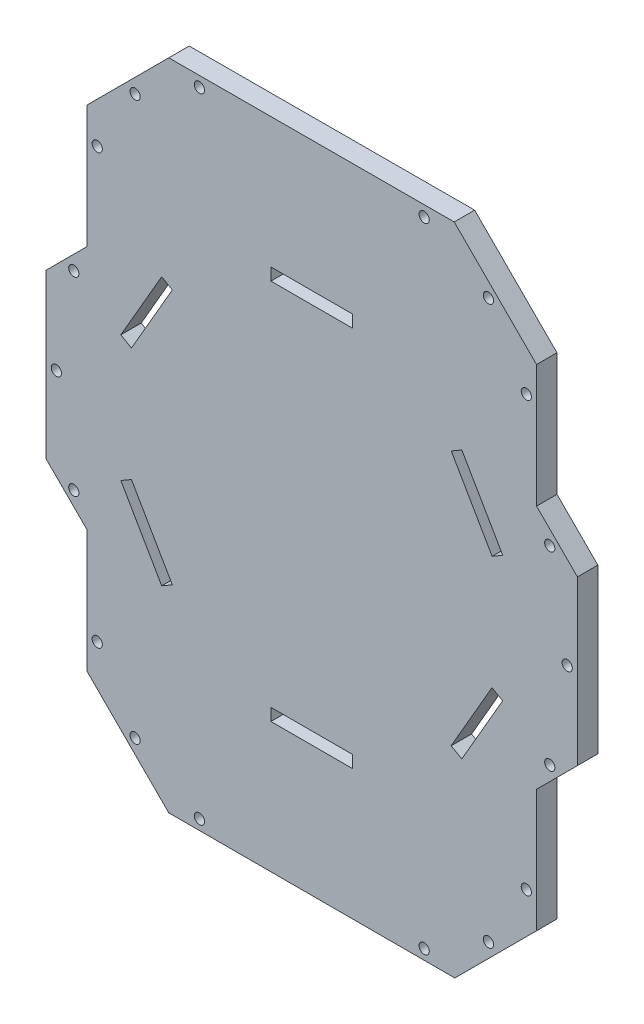
from build123d import *

# Parameters (mm, degrees)
MODEL_R             = 1.25
MODEL_W             = 20
MODEL_H             = 3
BOSS_EXTRUDE1_DEPTH = 5


with BuildPart() as part:
    # Model → Boss-Extrude1 (new body)
    with BuildSketch(Plane.XY):
        Polygon((112.443761684, 7.565594359), (132.443761684, 27.565594359), (132.443761684, 57.565594359), (142.443761684, 67.565594359), (142.443761684, 107.565594359), (132.443761684, 117.565594359), (132.443761684, 147.565594359), (112.298529785, 167.710826258), (42.447520771, 167.569353446), (22.443761684, 147.565594359), (22.443761684, 117.565594359), (12.443761684, 107.565594359), (12.443761684, 67.565594359), (22.443761684, 57.565594359), (22.443761684, 27.565594359), (42.443761684, 7.565594359), align=None)
        with Locations((104.943761684, 10.065594359)):
            Circle(MODEL_R, mode=Mode.SUBTRACT)
        with Locations((129.943761684, 35.065594359)):
            Circle(MODEL_R, mode=Mode.SUBTRACT)
        with Locations((120.675994731, 19.333361312)):
            Circle(MODEL_R, mode=Mode.SUBTRACT)
        with Locations((49.943761684, 10.065594359)):
            Circle(MODEL_R, mode=Mode.SUBTRACT)
        with Locations((24.943761684, 35.065594359)):
            Circle(MODEL_R, mode=Mode.SUBTRACT)
        with Locations((34.211528637, 19.333361312)):
            Circle(MODEL_R, mode=Mode.SUBTRACT)
        with Locations((104.943761684, 165.065594359)):
            Circle(MODEL_R, mode=Mode.SUBTRACT)
        with Locations((129.943761684, 140.065594359)):
            Circle(MODEL_R, mode=Mode.SUBTRACT)
        with Locations((120.675994731, 155.797827406)):
            Circle(MODEL_R, mode=Mode.SUBTRACT)
        with Locations((49.943761684, 165.065594359)):
            Circle(MODEL_R, mode=Mode.SUBTRACT)
        with Locations((24.943761684, 140.065594359)):
            Circle(MODEL_R, mode=Mode.SUBTRACT)
        with Locations((34.211528637, 155.797827406)):
            Circle(MODEL_R, mode=Mode.SUBTRACT)
        with Locations((19.211528637, 64.333361312)):
            Circle(MODEL_R, mode=Mode.SUBTRACT)
        with Locations((14.943761684, 87.565594359)):
            Circle(MODEL_R, mode=Mode.SUBTRACT)
        with Locations((19.211528637, 110.797827406)):
            Circle(MODEL_R, mode=Mode.SUBTRACT)
        with Locations((135.675994731, 64.333361312)):
            Circle(MODEL_R, mode=Mode.SUBTRACT)
        with Locations((139.943761684, 87.565594359)):
            Circle(MODEL_R, mode=Mode.SUBTRACT)
        with Locations((135.675994731, 110.797827406)):
            Circle(MODEL_R, mode=Mode.SUBTRACT)
        with Locations((77.443761684, 134.246405176)):
            Rectangle(MODEL_W, MODEL_H, mode=Mode.SUBTRACT)
        with Locations((77.443761684, 40.923947526)):
            Rectangle(MODEL_W, MODEL_H, mode=Mode.SUBTRACT)
        Polygon((111.546053861, 56.329621407), (114.144130073, 54.829621407), (124.144130073, 72.150129482), (121.546053861, 73.650129482), align=None, mode=Mode.SUBTRACT)
        Polygon((114.169567826, 120.316253805), (111.571491615, 118.816253805), (121.571491615, 101.49574573), (124.169567826, 102.99574573), align=None, mode=Mode.SUBTRACT)
        Polygon((40.717955541, 54.814934913), (43.316031753, 56.314934913), (33.316031753, 73.635442988), (30.717955541, 72.135442988), align=None, mode=Mode.SUBTRACT)
        Polygon((30.717955541, 102.99574573), (33.316031753, 101.49574573), (43.316031753, 118.816253805), (40.717955541, 120.316253805), align=None, mode=Mode.SUBTRACT)
    extrude(amount=BOSS_EXTRUDE1_DEPTH)


solid = part.part
